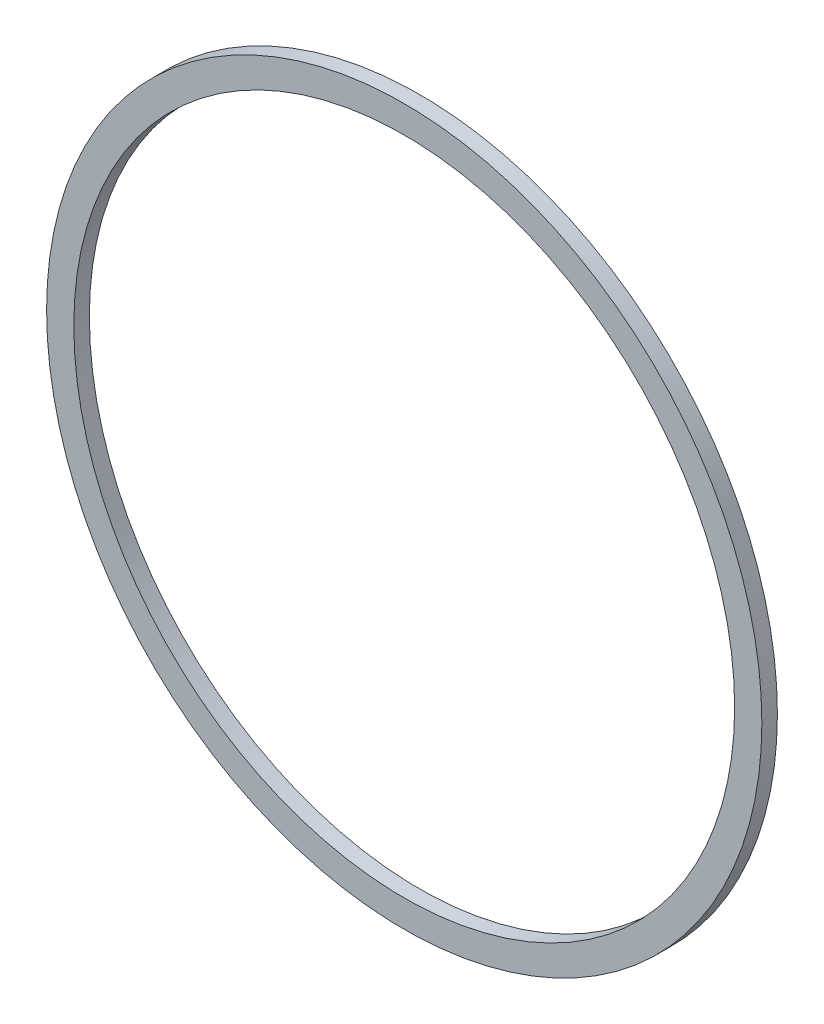
from build123d import *

# Parameters (mm, degrees)
SKETCH1_R           = 46
SKETCH1_R_2         = 42.5
BOSS_EXTRUDE1_DEPTH = 2


with BuildPart() as part:
    # Sketch1 → Boss-Extrude1 (new body)
    with BuildSketch(Plane.XY):
        Circle(SKETCH1_R)
        Circle(SKETCH1_R_2, mode=Mode.SUBTRACT)
    extrude(amount=-BOSS_EXTRUDE1_DEPTH)


solid = part.part
